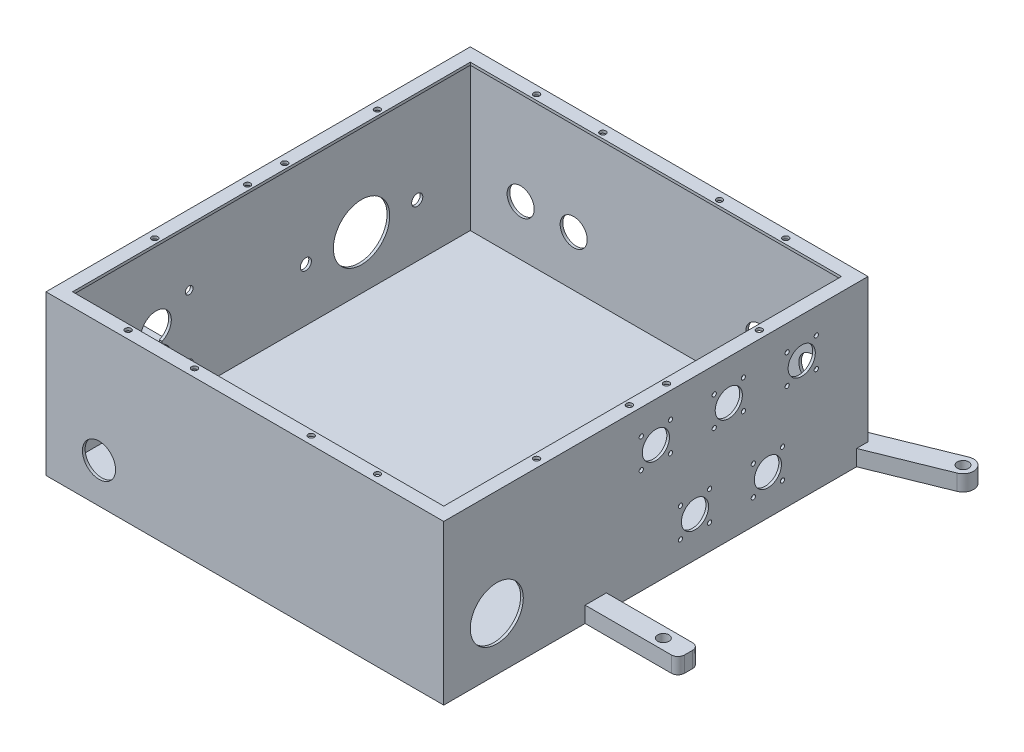
from build123d import *

# Parameters (mm, degrees)
SKETCH3_W             = 300
SKETCH3_H             = 320
BOSS_EXTRUDE3_DEPTH   = 2
SKETCH4_W             = 300
SKETCH4_H             = 320
SKETCH4_W_2           = 296
SKETCH4_H_2           = 316
BOSS_EXTRUDE4_DEPTH   = 120
SKETCH5_R             = 10.2
CUT_EXTRUDE1_DEPTH    = 120
SKETCH6_R             = 12.5
CUT_EXTRUDE2_DEPTH    = 120
SKETCH7_R             = 21.25
SKETCH7_R_2           = 4.2
SKETCH7_R_3           = 2.9
CUT_EXTRUDE4_DEPTH    = 18.5
SKETCH8_R             = 10.25
SKETCH8_R_2           = 1.6
SKETCH8_R_3           = 20
CUT_EXTRUDE5_DEPTH    = 10
SKETCH10_W            = 296
SKETCH10_H            = 316
SKETCH10_R            = 2.25
SKETCH10_W_2          = 280
SKETCH10_H_2          = 300
BOSS_EXTRUDE5_DEPTH   = 2
SKETCH12_R            = 4.25
BOSS_EXTRUDE7_DEPTH   = 12
SKETCH14_R            = 4.25
BOSS_EXTRUDE8_DEPTH   = 12
BOSS_EXTRUDE8_2_DEPTH = 12


with BuildPart() as part:
    # Sketch3 → Boss-Extrude3 (new body)
    with BuildSketch(Plane(origin=(0, 0, 0), x_dir=(1, 0, 0), z_dir=(0, 1, 0))):
        Rectangle(SKETCH3_W, SKETCH3_H)
    extrude(amount=BOSS_EXTRUDE3_DEPTH)

    # Sketch4 → Boss-Extrude4 (add)
    with BuildSketch(Plane(origin=(0, 0, 0), x_dir=(1, 0, 0), z_dir=(0, 1, 0))):
        Rectangle(SKETCH4_W, SKETCH4_H)
        Rectangle(SKETCH4_W_2, SKETCH4_H_2, mode=Mode.SUBTRACT)
    extrude(amount=BOSS_EXTRUDE4_DEPTH)

    # Sketch5 → Cut-Extrude1 (cut)
    with BuildSketch(Plane(origin=(0, 0, -160), x_dir=(-1, 0, 0), z_dir=(0, 0, -1))):
        with Locations((-110, 40)):
            Circle(SKETCH5_R)
        with Locations((-70, 40)):
            Circle(SKETCH5_R)
        with Locations((70, 40)):
            Circle(SKETCH5_R)
        with Locations((110, 40)):
            Circle(SKETCH5_R)
    extrude(amount=-CUT_EXTRUDE1_DEPTH, mode=Mode.SUBTRACT)

    # Sketch6 → Cut-Extrude2 (cut)
    with BuildSketch(Plane.XY.offset(160)):
        with Locations((-110, 30)):
            Circle(SKETCH6_R)
    extrude(amount=-CUT_EXTRUDE2_DEPTH, mode=Mode.SUBTRACT)

    # Sketch7 → Cut-Extrude4 (cut)
    with BuildSketch(Plane.ZY.offset(150)):
        with Locations((-76, 42)):
            Circle(SKETCH7_R)
        with Locations((-34, 42)):
            Circle(SKETCH7_R_2)
        with Locations((-118, 42)):
            Circle(SKETCH7_R_2)
        with Locations((54, 69)):
            Circle(SKETCH7_R_3)
        with Locations((104, 69)):
            Circle(SKETCH7_R_3)
        with Locations((54, 21)):
            Circle(SKETCH7_R_3)
        with Locations((104, 21)):
            Circle(SKETCH7_R_3)
        with BuildLine():
            Line((93.7, 40.25), (88.310612225, 40.25))
            ThreePointArc((88.310612225, 40.25), (75.924535841, 22.418866475), (74.5, 44.083005244))
            Line((74.5, 44.083005244), (74.5, 45.916994756))
            ThreePointArc((74.5, 45.916994756), (75.924535841, 67.581133525), (88.310612225, 49.75))
            Line((88.310612225, 49.75), (93.7, 49.75))
            Line((93.7, 49.75), (93.7, 40.25))
        make_face()
    extrude(amount=-CUT_EXTRUDE4_DEPTH, mode=Mode.SUBTRACT)

    # Sketch8 → Cut-Extrude5 (cut)
    with BuildSketch(Plane(origin=(150, 0, 0), x_dir=(0, 0, -1), z_dir=(1, 0, 0))):
        with Locations((110, 90)):
            Circle(SKETCH8_R)
        with Locations((121, 101)):
            Circle(SKETCH8_R_2)
        with Locations((99, 101)):
            Circle(SKETCH8_R_2)
        with Locations((121, 79)):
            Circle(SKETCH8_R_2)
        with Locations((99, 79)):
            Circle(SKETCH8_R_2)
        with Locations((55, 90)):
            Circle(SKETCH8_R)
        with Locations((66, 101)):
            Circle(SKETCH8_R_2)
        with Locations((44, 101)):
            Circle(SKETCH8_R_2)
        with Locations((66, 79)):
            Circle(SKETCH8_R_2)
        with Locations((44, 79)):
            Circle(SKETCH8_R_2)
        with Locations((0, 90)):
            Circle(SKETCH8_R)
        with Locations((11, 101)):
            Circle(SKETCH8_R_2)
        with Locations((-11, 101)):
            Circle(SKETCH8_R_2)
        with Locations((11, 79)):
            Circle(SKETCH8_R_2)
        with Locations((-11, 79)):
            Circle(SKETCH8_R_2)
        with Locations((84.5, 30)):
            Circle(SKETCH8_R)
        with Locations((95.5, 41)):
            Circle(SKETCH8_R_2)
        with Locations((95.5, 19)):
            Circle(SKETCH8_R_2)
        with Locations((73.5, 41)):
            Circle(SKETCH8_R_2)
        with Locations((73.5, 19)):
            Circle(SKETCH8_R_2)
        with Locations((29.5, 30)):
            Circle(SKETCH8_R)
        with Locations((40.5, 41)):
            Circle(SKETCH8_R_2)
        with Locations((40.5, 19)):
            Circle(SKETCH8_R_2)
        with Locations((18.5, 41)):
            Circle(SKETCH8_R_2)
        with Locations((18.5, 19)):
            Circle(SKETCH8_R_2)
        with Locations((-120, 40)):
            Circle(SKETCH8_R_3)
    extrude(amount=-CUT_EXTRUDE5_DEPTH, mode=Mode.SUBTRACT)

    # Sketch10 → Boss-Extrude5 (add)
    with BuildSketch(Plane(origin=(0, 120, 0), x_dir=(1, 0, 0), z_dir=(0, 1, 0))):
        Rectangle(SKETCH10_W, SKETCH10_H)
        with Locations(Location((-94, 154, 0), (0, 0, 270))):
            Circle(SKETCH10_R, mode=Mode.SUBTRACT)
        with Locations(Location((-44, 154, 0), (0, 0, 270))):
            Circle(SKETCH10_R, mode=Mode.SUBTRACT)
        with Locations(Location((-144, 84, 0), (0, 0, 270))):
            Circle(SKETCH10_R, mode=Mode.SUBTRACT)
        with Locations(Location((-144, 14, 0), (0, 0, 270))):
            Circle(SKETCH10_R, mode=Mode.SUBTRACT)
        with Locations(Location((144, 14, 0), (0, 0, 90))):
            Circle(SKETCH10_R, mode=Mode.SUBTRACT)
        with Locations(Location((144, 84, 0), (0, 0, 90))):
            Circle(SKETCH10_R, mode=Mode.SUBTRACT)
        with Locations(Location((44, 154, 0), (0, 0, 90))):
            Circle(SKETCH10_R, mode=Mode.SUBTRACT)
        with Locations(Location((94, 154, 0), (0, 0, 90))):
            Circle(SKETCH10_R, mode=Mode.SUBTRACT)
        with Locations(Location((94, -154, 0), (0, 0, 270))):
            Circle(SKETCH10_R, mode=Mode.SUBTRACT)
        with Locations(Location((44, -154, 0), (0, 0, 270))):
            Circle(SKETCH10_R, mode=Mode.SUBTRACT)
        with Locations(Location((144, -84, 0), (0, 0, 270))):
            Circle(SKETCH10_R, mode=Mode.SUBTRACT)
        with Locations(Location((144, -14, 0), (0, 0, 270))):
            Circle(SKETCH10_R, mode=Mode.SUBTRACT)
        with Locations(Location((-144, -14, 0), (0, 0, 90))):
            Circle(SKETCH10_R, mode=Mode.SUBTRACT)
        with Locations(Location((-144, -84, 0), (0, 0, 90))):
            Circle(SKETCH10_R, mode=Mode.SUBTRACT)
        with Locations(Location((-44, -154, 0), (0, 0, 90))):
            Circle(SKETCH10_R, mode=Mode.SUBTRACT)
        with Locations(Location((-94, -154, 0), (0, 0, 90))):
            Circle(SKETCH10_R, mode=Mode.SUBTRACT)
        Rectangle(SKETCH10_W_2, SKETCH10_H_2, mode=Mode.SUBTRACT)
    extrude(amount=-BOSS_EXTRUDE5_DEPTH)

    # Sketch12 → Boss-Extrude7 (add)
    # profile 1 of 2: a face of its own
    with BuildSketch(Plane(origin=(0, 0, 0), x_dir=(1, 0, 0), z_dir=(0, 1, 0))):
        with BuildLine():
            Line((150, -37.35), (215, -37.35))
            ThreePointArc((215, -37.35), (218.535533906, -38.814466094), (220, -42.35))
            Line((220, -42.35), (220, -48.35))
            ThreePointArc((220, -48.35), (218.535533906, -51.885533906), (215, -53.35))
            Line((215, -53.35), (150, -53.35))
            Line((150, -53.35), (150, -37.35))
        make_face()
        with Locations(Location((201, -45.35, 0), (0, 0, 270))):
            Circle(SKETCH12_R, mode=Mode.SUBTRACT)
    # profile 2 of 2: a face of its own
    with BuildSketch(Plane(origin=(0, 0, 0), x_dir=(1, 0, 0), z_dir=(0, 1, 0))):
        with BuildLine():
            Line((-220, -42.35), (-220, -48.35))
            ThreePointArc((-220, -48.35), (-218.535533906, -51.885533906), (-215, -53.35))
            Line((-215, -53.35), (-150, -53.35))
            Line((-150, -53.35), (-150, -37.35))
            Line((-150, -37.35), (-215, -37.35))
            ThreePointArc((-215, -37.35), (-218.535533906, -38.814466094), (-220, -42.35))
        make_face()
        with Locations(Location((-201, -45.35, 0), (0, 0, 90))):
            Circle(SKETCH12_R, mode=Mode.SUBTRACT)
    extrude(amount=BOSS_EXTRUDE7_DEPTH)


with BuildPart() as body_2:
    # Sketch14 → Boss-Extrude8 (new body)
    with BuildSketch(Plane(origin=(0, 0, 0), x_dir=(1, 0, 0), z_dir=(0, 1, 0))):
        with BuildLine():
            Line((128.683963847, 160), (197.99756561, 188.065213263))
            ThreePointArc((197.99756561, 188.065213263), (208.415213263, 183.65243439), (204.00243439, 173.234786737))
            Line((204.00243439, 173.234786737), (150, 151.369095165))
            Line((150, 151.369095165), (150, 160))
            Line((150, 160), (128.683963847, 160))
        make_face()
        with Locations(Location((201, 180.65, 0), (0, 0, 270))):
            Circle(SKETCH14_R, mode=Mode.SUBTRACT)
    extrude(amount=BOSS_EXTRUDE8_DEPTH)


with BuildPart() as body_3:
    # Sketch14 → Boss-Extrude8 2 (new body)
    with BuildSketch(Plane(origin=(0, 0, 0), x_dir=(1, 0, 0), z_dir=(0, 1, 0))):
        with BuildLine():
            Line((-128.683963847, 160), (-150, 160))
            Line((-150, 160), (-150, 151.369095165))
            Line((-150, 151.369095165), (-204.00243439, 173.234786737))
            ThreePointArc((-204.00243439, 173.234786737), (-208.415213263, 183.65243439), (-197.99756561, 188.065213263))
            Line((-197.99756561, 188.065213263), (-128.683963847, 160))
        make_face()
        with Locations(Location((-201, 180.65, 0), (0, 0, 90))):
            Circle(SKETCH14_R, mode=Mode.SUBTRACT)
    extrude(amount=BOSS_EXTRUDE8_2_DEPTH)


solid = Compound([part.part, body_2.part, body_3.part])
